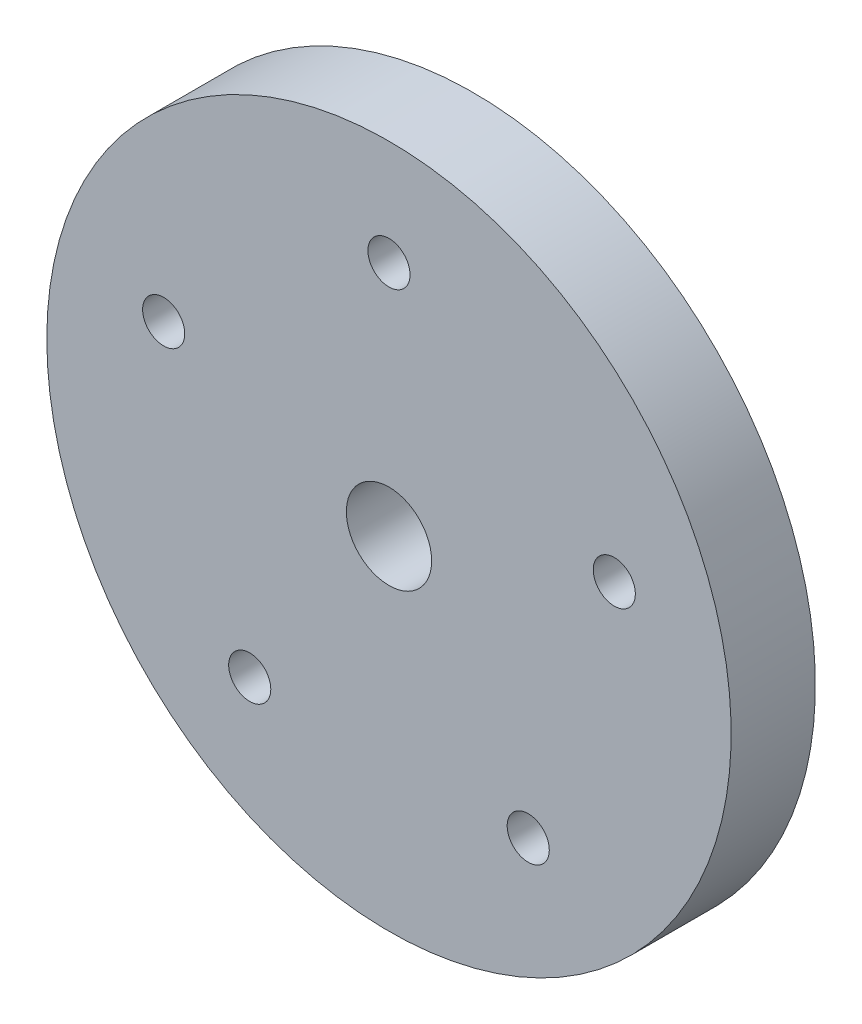
from build123d import *

# Parameters (mm, degrees)
F_4_0_4_HEAT_INSERT_M3_D         = 4
F_8_1_8_1_DURCHMESSER_BOHRUNG1_D = 8.1
SKIZZE8_R                        = 1.2
SCHNITT_LINEAR_AUSTRAGEN1_DEPTH  = 7
KREISMUSTER1_COUNT               = 5


with BuildPart() as part:
    # Skizze1 → Rotation1 (revolve)
    with BuildSketch(Plane(origin=(0, 0, 0), x_dir=(0, 0, -1), z_dir=(1, 0, 0)), mode=Mode.PRIVATE) as rotation1_sk:
        Polygon((0, 0), (20, 0), (20, 15), (8, 15), (8, 32.5), (0, 32.5), align=None)
    revolve(rotation1_sk.sketch.rotate(Axis((0, 0, 0), (0, 0, 1)), 90), axis=Axis((0, 0, 0), (0, 0, 1)))

    # Ø4.0 (4) Heat Insert M3 (through all)
    with Locations(Plane.XY):
        with Locations((0, 22.5)):
            f_4_0_4_heat_insert_m3 = Hole(F_4_0_4_HEAT_INSERT_M3_D / 2)

    # Ø8.1 (8.1) Durchmesser Bohrung1 (through all)
    with Locations(Plane.XY):
        with Locations((0, 0)):
            Hole(F_8_1_8_1_DURCHMESSER_BOHRUNG1_D / 2)

    # Skizze8 → Schnitt-Linear austragen1 (cut)
    with BuildSketch(Plane(origin=(0, 0, -20), x_dir=(-1, 0, 0), z_dir=(0, 0, -1))):
        with Locations((0, 10)):
            Circle(SKIZZE8_R)
        with Locations((8.660254038, -5)):
            Circle(SKIZZE8_R)
        with Locations((-8.660254038, -5)):
            Circle(SKIZZE8_R)
    extrude(amount=-SCHNITT_LINEAR_AUSTRAGEN1_DEPTH, mode=Mode.SUBTRACT)

    # Kreismuster1: Ø4.0 (4) Heat Insert M3 ×5 about axis
    kreismuster1_axis = Axis((0, 0, 0), (0, 0, 1))
    for i in range(1, KREISMUSTER1_COUNT):
        add(f_4_0_4_heat_insert_m3.rotate(kreismuster1_axis, i * 360 / KREISMUSTER1_COUNT), mode=Mode.SUBTRACT)


solid = part.part
